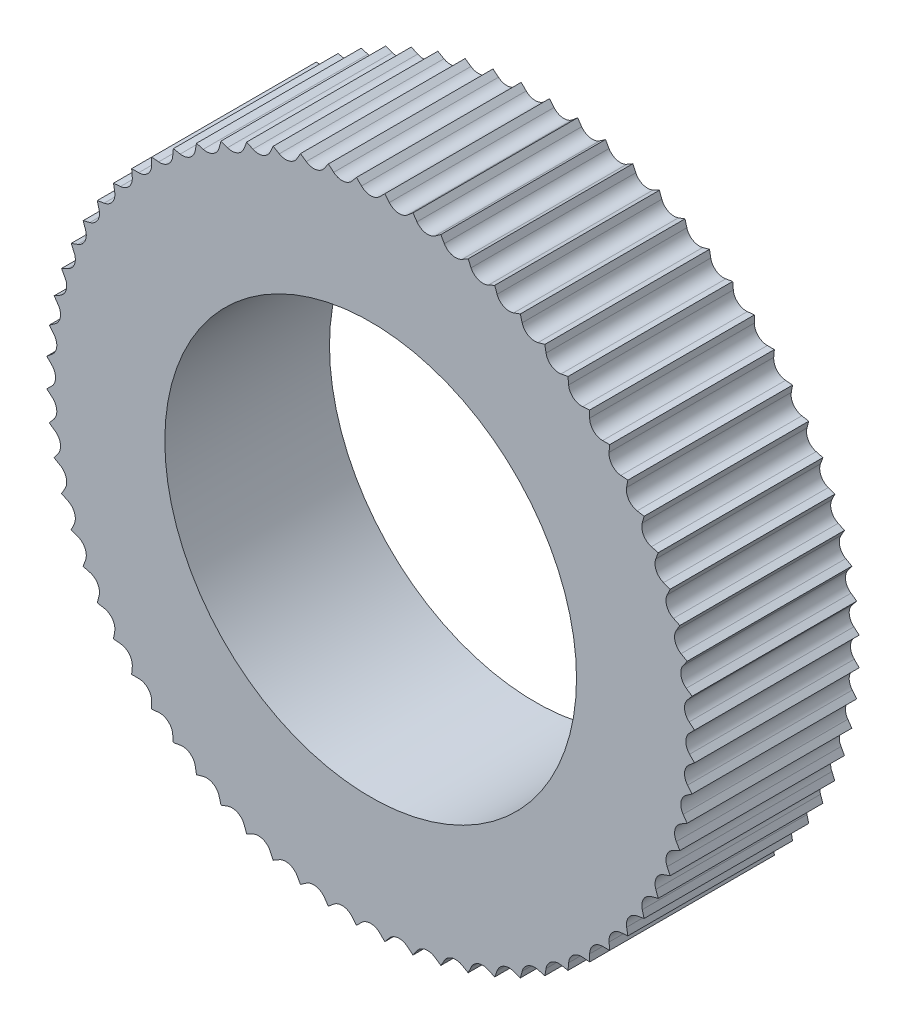
from build123d import *

# Parameters (mm, degrees)
SKETCH1_R           = 12.5
SKETCH1_R_2         = 6.35
BOSS_EXTRUDE1_DEPTH = 5.08
CUT_EXTRUDE1_DEPTH  = 19.393107405
CIRPATTERN1_COUNT   = 72


with BuildPart() as part:
    # Sketch1 → Boss-Extrude1 (new body)
    with BuildSketch(Plane.XY):
        Circle(SKETCH1_R)
        Circle(SKETCH1_R_2, mode=Mode.SUBTRACT)
    extrude(amount=BOSS_EXTRUDE1_DEPTH)

    # Sketch2 → Cut-Extrude1 (cut, through all)
    with BuildSketch(Plane.XY.offset(5.08)):
        with BuildLine():
            Line((-2.659514593, 12.213802935), (-0.282842712, 9.837131055))
            ThreePointArc((-0.282842712, 9.837131055), (0, 9.719973767), (0.282842712, 9.837131055))
            Line((0.282842712, 9.837131055), (2.659514593, 12.213802935))
            ThreePointArc((2.659514593, 12.213802935), (0, 12.5), (-2.659514593, 12.213802935))
        make_face()
    cut_extrude1 = extrude(amount=-CUT_EXTRUDE1_DEPTH, mode=Mode.SUBTRACT)

    # CirPattern1: Cut-Extrude1 ×72 about axis
    cirpattern1_axis = Axis((0, 0, 0), (0, 0, 1))
    for i in range(1, CIRPATTERN1_COUNT):
        add(cut_extrude1.rotate(cirpattern1_axis, i * 360 / CIRPATTERN1_COUNT), mode=Mode.SUBTRACT)


solid = part.part
